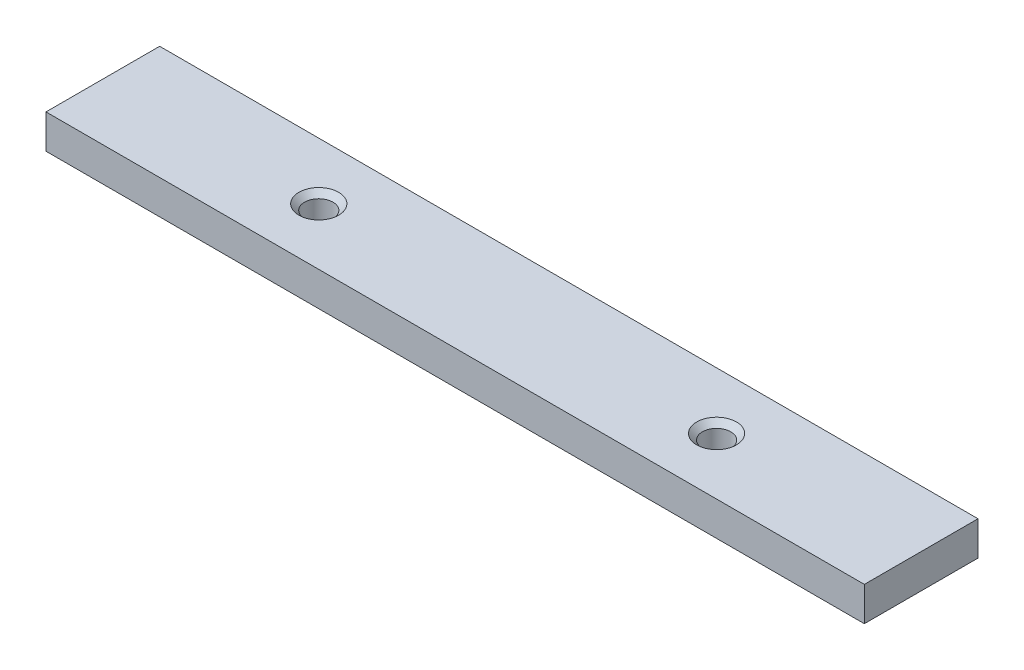
from build123d import *

# Parameters (mm, degrees)
SKETCH2_W                                         = 144
SKETCH2_H                                         = 20
BOSS_EXTRUDE1_DEPTH                               = 3
CSK_FOR_0_FLAT_HEAD_MACHINE_SCREW_100_D           = 4.999999906
CSK_FOR_0_FLAT_HEAD_MACHINE_SCREW_100_CSINK_D     = 6.99999997
CSK_FOR_0_FLAT_HEAD_MACHINE_SCREW_100_CSINK_ANGLE = 90


with BuildPart() as part:
    # Sketch2 → Boss-Extrude1 (new, symmetric)
    with BuildSketch(Plane(origin=(0, 0, 0), x_dir=(1, 0, 0), z_dir=(0, 1, 0))):
        Rectangle(SKETCH2_W, SKETCH2_H)
    extrude(amount=BOSS_EXTRUDE1_DEPTH, both=True)

    # CSK for #0 Flat Head Machine Screw (100)1 (through all)
    with Locations(Plane(origin=(-34, 3, 0), x_dir=(0, 0, 1), z_dir=(0, 1, 0))):
        with Locations((0, 0), (0, 70)):
            CounterSinkHole(CSK_FOR_0_FLAT_HEAD_MACHINE_SCREW_100_D / 2, CSK_FOR_0_FLAT_HEAD_MACHINE_SCREW_100_CSINK_D / 2, counter_sink_angle=CSK_FOR_0_FLAT_HEAD_MACHINE_SCREW_100_CSINK_ANGLE)


solid = part.part
